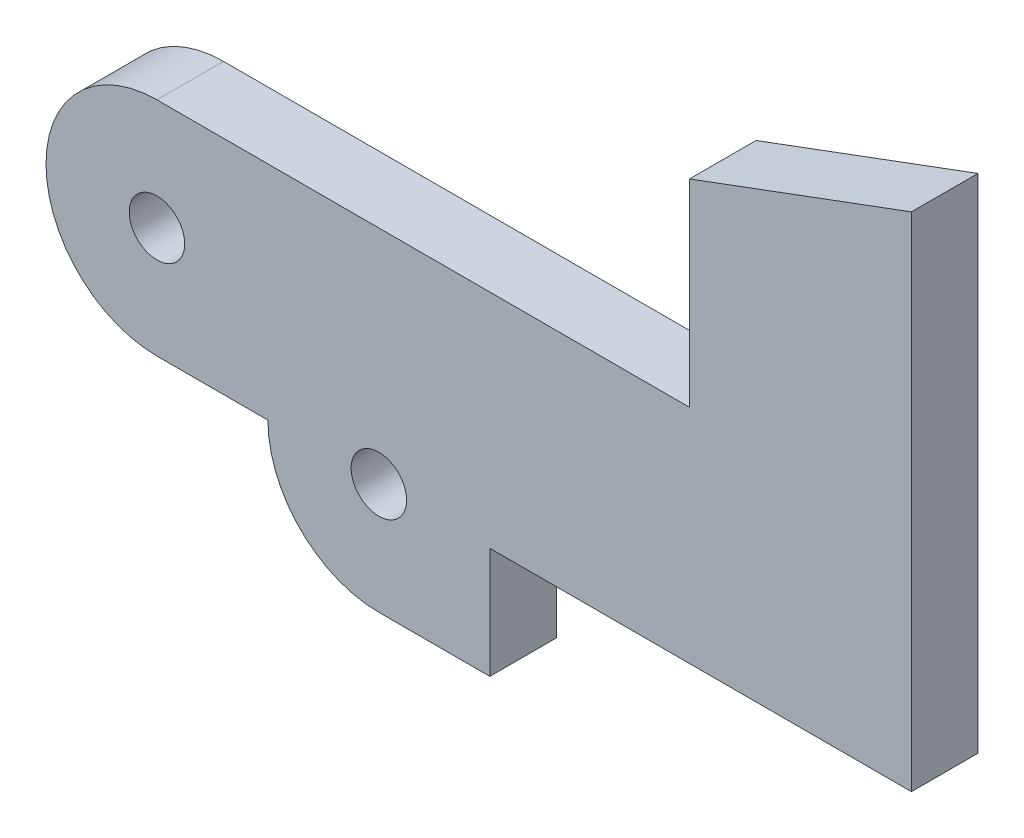
from build123d import *

# Parameters (mm, degrees)
SKETCH2_R           = 1.5
BOSS_EXTRUDE3_DEPTH = 3
BOSS_EXTRUDE4_DEPTH = 3
SKETCH4_R           = 1.25
CUT_EXTRUDE1_DEPTH  = 3
BOSS_EXTRUDE5_DEPTH = 3
CUT_EXTRUDE2_DEPTH  = 3
BOSS_EXTRUDE6_START = -3
SKETCH7_R           = 1.5
SKETCH7_R_2         = 1.25
BOSS_EXTRUDE6_DEPTH = 3
CUT_EXTRUDE3_DEPTH  = 10
BOSS_EXTRUDE7_DEPTH = 3


with BuildPart() as part:
    # Sketch2 → Boss-Extrude3 (new body)
    with BuildSketch(Plane.XY):
        with BuildLine():
            Line((-69.686145903, 39.746340023), (-34.686145903, 39.746340023))
            Line((-34.686145903, 39.746340023), (-34.686145903, 59.746340023))
            Line((-34.686145903, 59.746340023), (-69.686145903, 49.746340023))
            ThreePointArc((-69.686145903, 49.746340023), (-74.686145903, 44.746340023), (-69.686145903, 39.746340023))
        make_face()
        with Locations((-69.686145903, 44.746340023)):
            Circle(SKETCH2_R, mode=Mode.SUBTRACT)
    extrude(amount=BOSS_EXTRUDE3_DEPTH)

    # Sketch3 → Boss-Extrude4 (add)
    with BuildSketch(Plane.XY.offset(3)):
        with BuildLine():
            Line((-64.686145903, 39.746340023), (-59.686145903, 39.746340023))
            Line((-59.686145903, 39.746340023), (-54.686145903, 39.746340023))
            ThreePointArc((-54.686145903, 39.746340023), (-59.686145903, 34.746340023), (-64.686145903, 39.746340023))
        make_face()
    extrude(amount=-BOSS_EXTRUDE4_DEPTH)

    # Sketch4 → Cut-Extrude1 (cut)
    with BuildSketch(Plane.XY.offset(3)):
        with Locations((-59.686145903, 39.746340023)):
            Circle(SKETCH4_R)
    extrude(amount=-CUT_EXTRUDE1_DEPTH, mode=Mode.SUBTRACT)

    # Sketch5 → Boss-Extrude5 (add)
    with BuildSketch(Plane.XY.offset(3)):
        Polygon((-34.686145903, 59.746340023), (-34.686145903, 62.746340023), (-69.686145903, 49.746340023), align=None)
    extrude(amount=-BOSS_EXTRUDE5_DEPTH)

    # Sketch6 → Cut-Extrude2 (cut)
    with BuildSketch(Plane.XY.offset(3)):
        Polygon((-34.686145903, 39.746340023), (-35.686145903, 39.746340023), (-35.686145903, 63.560014977), (-33.928047703, 63.560014977), (-33.928047703, 39.746340023), align=None)
    extrude(amount=-CUT_EXTRUDE2_DEPTH, mode=Mode.SUBTRACT)

    # Sketch7 → Boss-Extrude6 (add)
    with BuildSketch(Plane.XY.offset(3).offset(BOSS_EXTRUDE6_START)):
        with Locations((-69.686145903, 44.746340023)):
            Circle(SKETCH7_R)
        with Locations((-69.686145903, 44.746340023)):
            Circle(SKETCH7_R_2, mode=Mode.SUBTRACT)
    extrude(amount=BOSS_EXTRUDE6_DEPTH)

    # Sketch8 → Cut-Extrude3 (cut)
    with BuildSketch(Plane.XY.offset(3)):
        Polygon((-69.686145903, 49.746340023), (-45.686145903, 49.746340023), (-45.686145903, 58.660625737), align=None)
    extrude(amount=-CUT_EXTRUDE3_DEPTH, mode=Mode.SUBTRACT)

    # Sketch9 → Boss-Extrude7 (add)
    with BuildSketch(Plane.XY.offset(3)):
        with BuildLine():
            Line((-59.686145903, 34.746340023), (-54.686145903, 34.746340023))
            Line((-54.686145903, 34.746340023), (-54.686145903, 39.746340023))
            ThreePointArc((-54.686145903, 39.746340023), (-56.150611997, 36.210806117), (-59.686145903, 34.746340023))
        make_face()
    extrude(amount=-BOSS_EXTRUDE7_DEPTH)


solid = part.part
